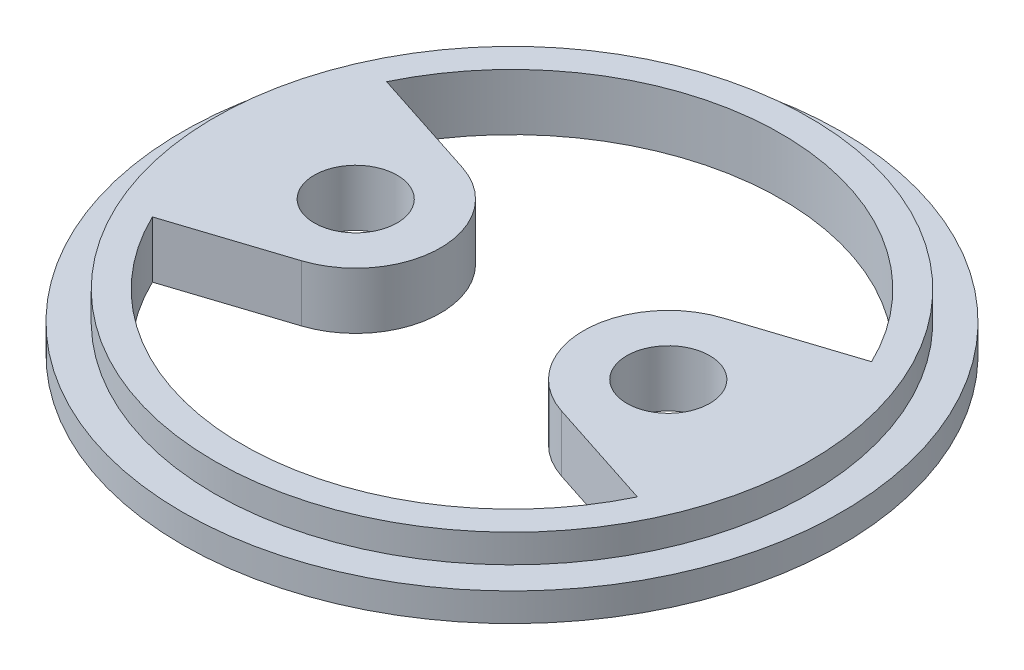
from build123d import *

# Parameters (mm, degrees)
SKETCH2_R           = 17.5
SKETCH2_R_2         = 2.2
BOSS_EXTRUDE2_DEPTH = 3
SKETCH3_OUTSIDE_W   = 46.918
SKETCH3_OUTSIDE_H   = 46.918
SKETCH3_OUTSIDE_R   = 15.8
CUT_EXTRUDE1_DEPTH  = 1.5
CUT_EXTRUDE2_DEPTH  = 25.929901725


with BuildPart() as part:
    # Sketch2 → Boss-Extrude2 (new body)
    with BuildSketch(Plane(origin=(0, 0, 0), x_dir=(1, 0, 0), z_dir=(0, 1, 0))):
        with Locations(Location((0, 0, 0), (0, 0, 270))):
            Circle(SKETCH2_R)
        with Locations(Location((-8.3, 0, 0), (0, 0, 270))):
            Circle(SKETCH2_R_2, mode=Mode.SUBTRACT)
        with Locations(Location((8.3, 0, 0), (0, 0, 90))):
            Circle(SKETCH2_R_2, mode=Mode.SUBTRACT)
    extrude(amount=BOSS_EXTRUDE2_DEPTH)

    # Sketch3 outside → Cut-Extrude1 (cut)
    with BuildSketch(Plane(origin=(0, 3, 0), x_dir=(1, 0, 0), z_dir=(0, 1, 0))):
        Rectangle(SKETCH3_OUTSIDE_W, SKETCH3_OUTSIDE_H)
        with Locations(Location((0, 0, 0), (0, 0, 270))):
            Circle(SKETCH3_OUTSIDE_R, mode=Mode.SUBTRACT)
    extrude(amount=-CUT_EXTRUDE1_DEPTH, mode=Mode.SUBTRACT)

    # Sketch4 → Cut-Extrude2 (cut, through all)
    with BuildSketch(Plane(origin=(0, 3, 0), x_dir=(1, 0, 0), z_dir=(0, 1, 0))):
        with BuildLine():
            ThreePointArc((-6.909423525, 4.279754323), (-3.8, 0), (-6.909423525, -4.279754323))
            Line((-6.909423525, -4.279754323), (-12.877005888, -6.218739372))
            ThreePointArc((-12.877005888, -6.218739372), (0, -14.3), (12.877005888, -6.218739372))
            Line((12.877005888, -6.218739372), (6.909423525, -4.279754323))
            ThreePointArc((6.909423525, -4.279754323), (3.8, 0), (6.909423525, 4.279754323))
            Line((6.909423525, 4.279754323), (12.877005888, 6.218739372))
            ThreePointArc((12.877005888, 6.218739372), (0, 14.3), (-12.877005888, 6.218739372))
            Line((-12.877005888, 6.218739372), (-6.909423525, 4.279754323))
        make_face()
    extrude(amount=-CUT_EXTRUDE2_DEPTH, mode=Mode.SUBTRACT)


solid = part.part
